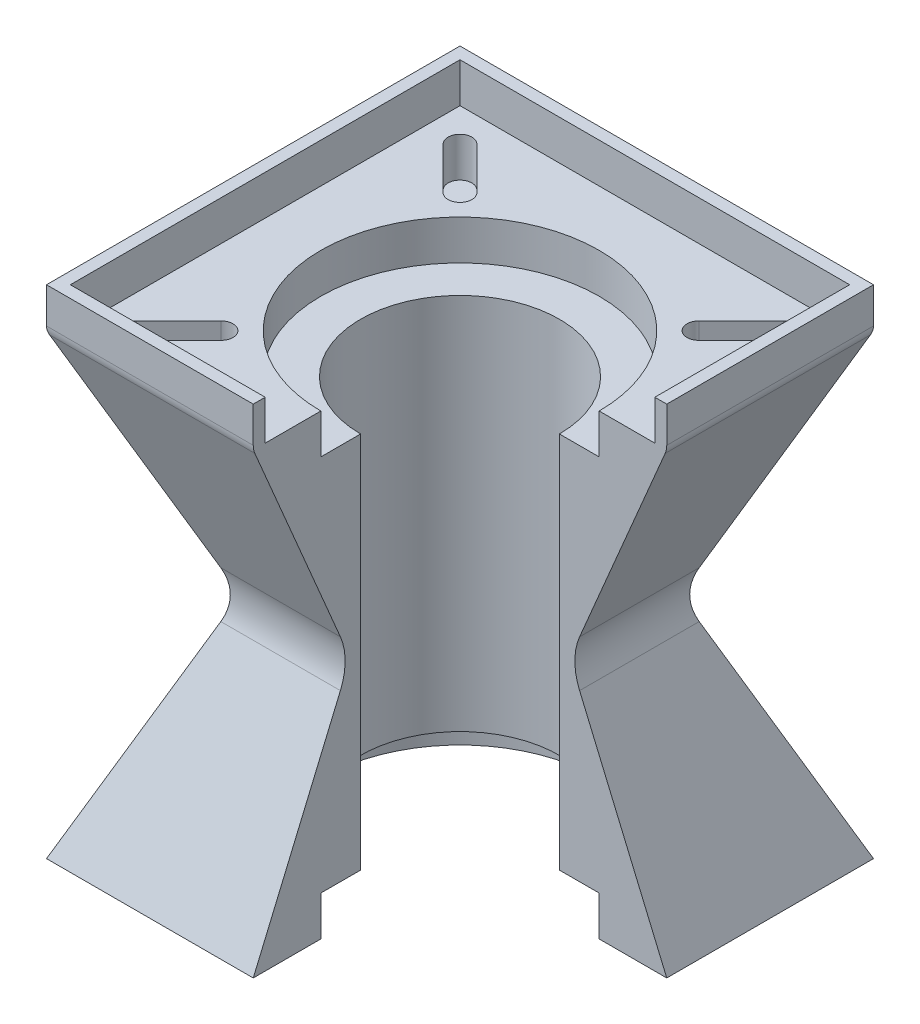
from build123d import *

# Parameters (mm, degrees)
BOSS_EXTRUDE1_DEPTH = 52
CUT_EXTRUDE1_DEPTH  = 52
SKETCH5_R           = 25
CUT_EXTRUDE2_DEPTH  = 137.502747225
SKETCH6_R           = 35
CUT_EXTRUDE4_DEPTH  = 10
CUT_EXTRUDE5_START  = -10
SKETCH7_R           = 35
CUT_EXTRUDE5_DEPTH  = 10
FILLET1_R           = 15
SKETCH9_W           = 52
SKETCH9_H           = 52
CUT_EXTRUDE7_DEPTH  = 137.502747225
BOSS_EXTRUDE2_DEPTH = 10
FILLET2_R           = 5
CUT_EXTRUDE12_DEPTH = 10


with BuildPart() as part:
    # Sketch1 → Boss-Extrude1 (new, symmetric)
    with BuildSketch(Plane.XY):
        Polygon((52, 57.5), (-52, 57.5), (-27.592698068, 0), (-52, -57.5), (52, -57.5), (27.592698068, 0), align=None)
    extrude(amount=BOSS_EXTRUDE1_DEPTH, both=True)

    # Sketch4 → Cut-Extrude1 (cut, symmetric)
    with BuildSketch(Plane(origin=(0, 0, 0), x_dir=(0, 0, -1), z_dir=(1, 0, 0))):
        Polygon((-52, 57.5), (-27.592698068, 0), (-52, -57.5), align=None)
        Polygon((27.592698068, 0), (52, -57.5), (52, 57.5), align=None)
    extrude(amount=CUT_EXTRUDE1_DEPTH, both=True, mode=Mode.SUBTRACT)

    # Sketch5 → Cut-Extrude2 (cut, through all)
    with BuildSketch(Plane(origin=(0, 57.5, 0), x_dir=(1, 0, 0), z_dir=(0, 1, 0))):
        with Locations(Location((0, 0, 0), (0, 0, 270))):
            Circle(SKETCH5_R)
    extrude(amount=-CUT_EXTRUDE2_DEPTH, mode=Mode.SUBTRACT)

    # Sketch6 → Cut-Extrude4 (cut)
    with BuildSketch(Plane(origin=(0, 57.5, 0), x_dir=(1, 0, 0), z_dir=(0, 1, 0))):
        with Locations(Location((0, 0, 0), (0, 0, 270))):
            Circle(SKETCH6_R)
    extrude(amount=-CUT_EXTRUDE4_DEPTH, mode=Mode.SUBTRACT)

    # Sketch7 → Cut-Extrude5 (cut)
    with BuildSketch(Plane.XZ.offset(57.5).offset(CUT_EXTRUDE5_START)):
        with Locations(Location((0, 0, 0), (0, 0, 90))):
            Circle(SKETCH7_R)
    extrude(amount=CUT_EXTRUDE5_DEPTH, mode=Mode.SUBTRACT)

    # Fillet1
    fillet1_edges = [part.edges().sort_by_distance(p)[0] for p in [
        (-27.592698068, 0, 0),
        (27.592698068, 0, 0),
        (0, 0, 27.592698068),
        (0, 0, -27.592698068),
    ]]
    fillet(fillet1_edges, radius=FILLET1_R)

    # Sketch9 → Cut-Extrude7 (cut, through all)
    with BuildSketch(Plane(origin=(0, 57.5, 0), x_dir=(1, 0, 0), z_dir=(0, 1, 0))):
        with Locations((26, -26)):
            Rectangle(SKETCH9_W, SKETCH9_H)
    extrude(amount=-CUT_EXTRUDE7_DEPTH, mode=Mode.SUBTRACT)

    # Sketch11 → Boss-Extrude2 (add)
    with BuildSketch(Plane(origin=(0, 57.5, 0), x_dir=(1, 0, 0), z_dir=(0, 1, 0))):
        Polygon((49, 0), (49, 49), (-49, 49), (-49, -49), (0, -49), (0, -52), (-52, -52), (-52, 52), (52, 52), (52, 0), align=None)
    extrude(amount=BOSS_EXTRUDE2_DEPTH)

    # Fillet2
    fillet2_edges = [part.edges().sort_by_distance(p)[0] for p in [
        (-26, 57.5, 52),
        (52, 57.5, -26),
        (-52, 57.5, 0),
        (0, 57.5, -52),
    ]]
    fillet(fillet2_edges, radius=FILLET2_R)

    # Sketch15 → Cut-Extrude12 (cut)
    with BuildSketch(Plane(origin=(0, 57.5, 0), x_dir=(1, 0, 0), z_dir=(0, 1, 0))):
        with BuildLine():
            Line((-38.537319575, 42.779960262), (-27.930717857, 32.173358544))
            ThreePointArc((-27.930717857, 32.173358544), (-27.930717857, 27.930717857), (-32.173358544, 27.930717857))
            Line((-32.173358544, 27.930717857), (-42.779960262, 38.537319575))
            ThreePointArc((-42.779960262, 38.537319575), (-42.779960262, 42.779960262), (-38.537319575, 42.779960262))
        make_face()
        with BuildLine():
            Line((38.537319575, 42.779960262), (27.930717857, 32.173358544))
            ThreePointArc((27.930717857, 32.173358544), (27.930717857, 27.930717857), (32.173358544, 27.930717857))
            Line((32.173358544, 27.930717857), (42.779960262, 38.537319575))
            ThreePointArc((42.779960262, 38.537319575), (42.779960262, 42.779960262), (38.537319575, 42.779960262))
        make_face()
        with BuildLine():
            Line((-38.537319575, -42.779960262), (-27.930717857, -32.173358544))
            ThreePointArc((-27.930717857, -32.173358544), (-27.930717857, -27.930717857), (-32.173358544, -27.930717857))
            Line((-32.173358544, -27.930717857), (-42.779960262, -38.537319575))
            ThreePointArc((-42.779960262, -38.537319575), (-42.779960262, -42.779960262), (-38.537319575, -42.779960262))
        make_face()
    extrude(amount=-CUT_EXTRUDE12_DEPTH, mode=Mode.SUBTRACT)


solid = part.part
